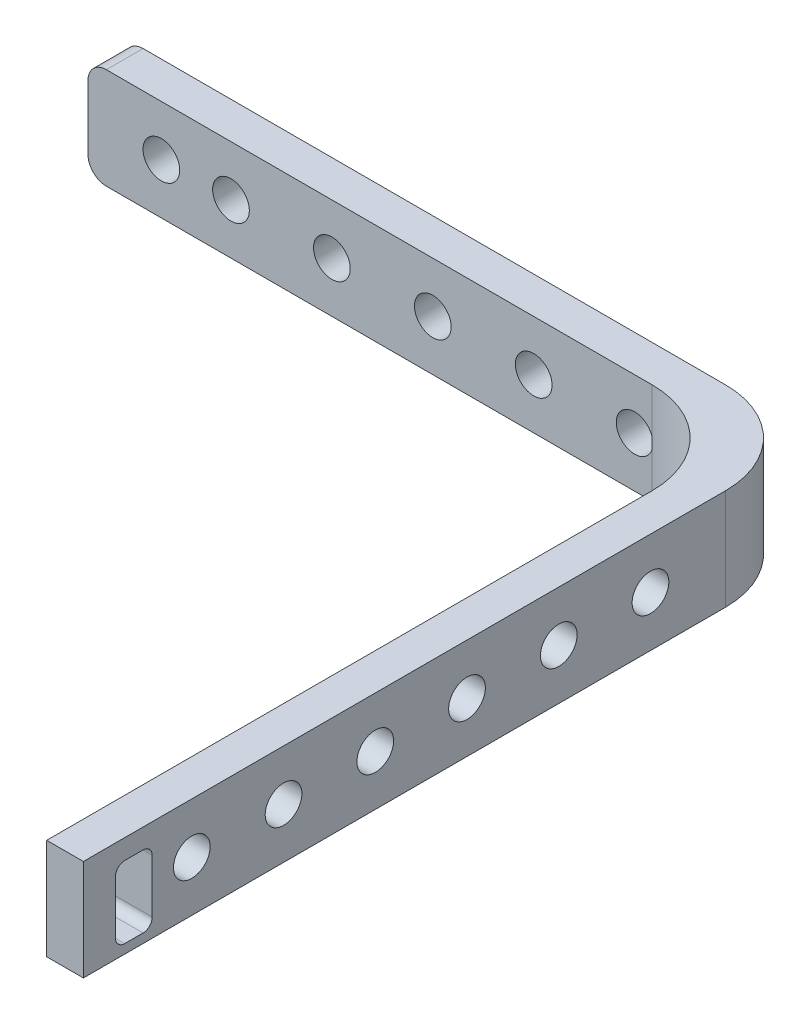
from build123d import *

# Parameters (mm, degrees)
SKETCH2_W           = 71.5
SKETCH2_H           = 11
BOSS_EXTRUDE2_DEPTH = 4
SKETCH3_R           = 2
CUT_EXTRUDE1_DEPTH  = 4
SKETCH4_W           = 4
SKETCH4_H           = 4
BOSS_EXTRUDE3_DEPTH = 11
SKETCH5_W           = 4
SKETCH5_H           = 11
BOSS_EXTRUDE4_DEPTH = 76
CUT_EXTRUDE2_DEPTH  = 4
FILLET1_R           = 10
FILLET2_R           = 10
FILLET4_R           = 2
SKETCH7_R           = 2
CUT_EXTRUDE3_DEPTH  = 4
SKETCH8_R           = 2
CUT_EXTRUDE4_DEPTH  = 4


with BuildPart() as part:
    # Sketch2 → Boss-Extrude2 (new body)
    with BuildSketch(Plane.XY):
        with Locations((35.75, 5.5)):
            Rectangle(SKETCH2_W, SKETCH2_H)
    extrude(amount=BOSS_EXTRUDE2_DEPTH)

    # Sketch3 → Cut-Extrude1 (cut)
    with BuildSketch(Plane.XY.offset(4)):
        with Locations((8, 5.5)):
            Circle(SKETCH3_R)
    extrude(amount=-CUT_EXTRUDE1_DEPTH, mode=Mode.SUBTRACT)

    # Sketch4 → Boss-Extrude3 (add)
    with BuildSketch(Plane(origin=(0, 11, 0), x_dir=(1, 0, 0), z_dir=(0, 1, 0))):
        with Locations((73.5, -2)):
            Rectangle(SKETCH4_W, SKETCH4_H)
    extrude(amount=-BOSS_EXTRUDE3_DEPTH)

    # Sketch5 → Boss-Extrude4 (add)
    with BuildSketch(Plane.XY.offset(4)):
        with Locations((73.5, 5.5)):
            Rectangle(SKETCH5_W, SKETCH5_H)
    extrude(amount=BOSS_EXTRUDE4_DEPTH)

    # Sketch6 → Cut-Extrude2 (cut)
    with BuildSketch(Plane(origin=(75.5, 0, 0), x_dir=(0, 0, -1), z_dir=(1, 0, 0))):
        with BuildLine():
            Line((-75.5, 1), (-73.5, 1))
            ThreePointArc((-73.5, 1), (-72.792893219, 1.292893219), (-72.5, 2))
            Line((-72.5, 2), (-72.5, 7.838562936))
            ThreePointArc((-72.5, 7.838562936), (-72.792893219, 8.545669717), (-73.5, 8.838562936))
            Line((-73.5, 8.838562936), (-75.5, 8.838562936))
            ThreePointArc((-75.5, 8.838562936), (-76.207106781, 8.545669717), (-76.5, 7.838562936))
            Line((-76.5, 7.838562936), (-76.5, 2))
            ThreePointArc((-76.5, 2), (-76.207106781, 1.292893219), (-75.5, 1))
        make_face()
    extrude(amount=-CUT_EXTRUDE2_DEPTH, mode=Mode.SUBTRACT)

    # Fillet1
    fillet1_edges = [part.edges().sort_by_distance(p)[0] for p in [
        (71.5, 5.5, 4),
    ]]
    fillet(fillet1_edges, radius=FILLET1_R)

    # Fillet2
    fillet2_edges = [part.edges().sort_by_distance(p)[0] for p in [
        (75.5, 5.5, 0),
    ]]
    fillet(fillet2_edges, radius=FILLET2_R)

    # Fillet4
    fillet4_edges = [part.edges().sort_by_distance(p)[0] for p in [
        (0, 11, 2),
        (0, 0, 2),
    ]]
    fillet(fillet4_edges, radius=FILLET4_R)

    # Sketch7 → Cut-Extrude3 (cut)
    with BuildSketch(Plane(origin=(0, 0, 0), x_dir=(-1, 0, 0), z_dir=(0, 0, -1))):
        with Locations((-15.588658676, 5.5)):
            Circle(SKETCH7_R)
        with Locations((-26.588658676, 5.5)):
            Circle(SKETCH7_R)
        with Locations((-37.588658676, 5.5)):
            Circle(SKETCH7_R)
        with Locations((-48.588658676, 5.5)):
            Circle(SKETCH7_R)
        with Locations((-59.588658676, 5.5)):
            Circle(SKETCH7_R)
    extrude(amount=-CUT_EXTRUDE3_DEPTH, mode=Mode.SUBTRACT)

    # Sketch8 → Cut-Extrude4 (cut)
    with BuildSketch(Plane.ZY.offset(-71.5)):
        with Locations((18.18197142, 5.5)):
            Circle(SKETCH8_R)
        with Locations((28.18197142, 5.5)):
            Circle(SKETCH8_R)
        with Locations((38.18197142, 5.5)):
            Circle(SKETCH8_R)
        with Locations((48.18197142, 5.5)):
            Circle(SKETCH8_R)
        with Locations((58.18197142, 5.5)):
            Circle(SKETCH8_R)
        with Locations((68.18197142, 5.5)):
            Circle(SKETCH8_R)
    extrude(amount=-CUT_EXTRUDE4_DEPTH, mode=Mode.SUBTRACT)


solid = part.part
